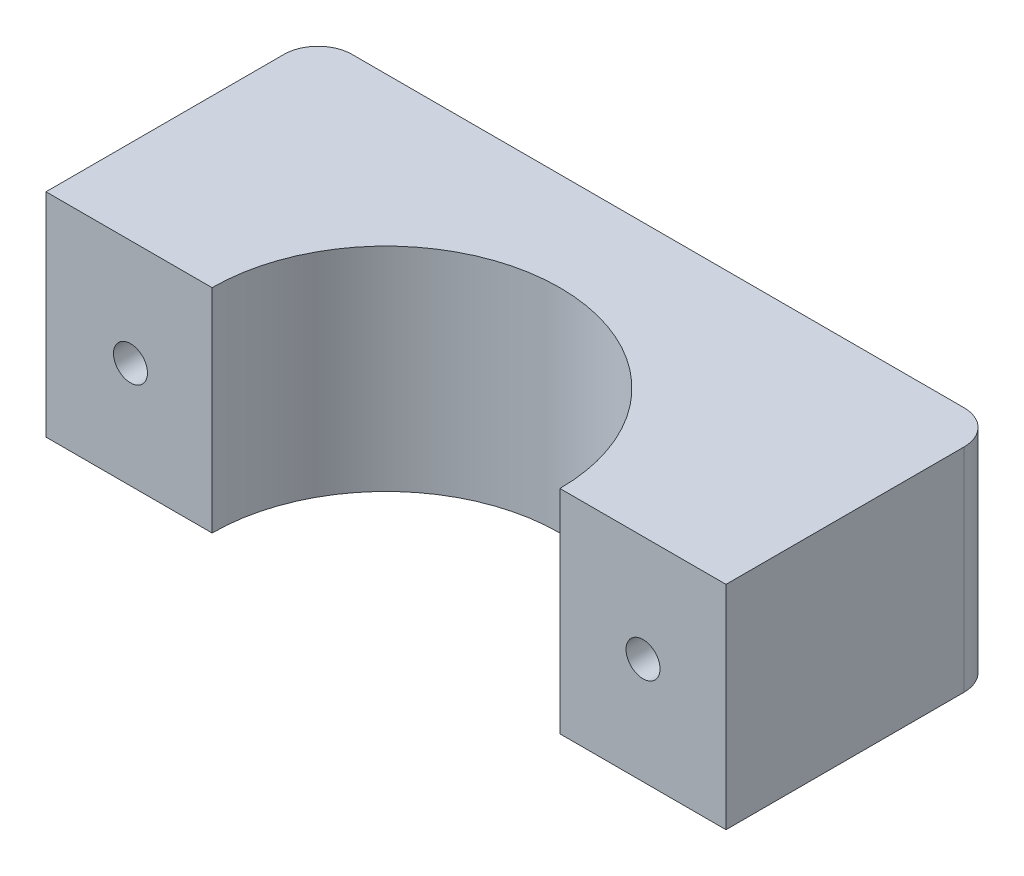
from build123d import *

# Parameters (mm, degrees)
BOSS_EXTRUDE1_DEPTH = 15.875
SKETCH2_R           = 1.27
CUT_EXTRUDE1_DEPTH  = 57.969799236
SKETCH3_R           = 3.81
CUT_EXTRUDE2_DEPTH  = 4.1275


with BuildPart() as part:
    # Sketch1 → Boss-Extrude1 (new body)
    with BuildSketch(Plane(origin=(0, 0, 0), x_dir=(1, 0, 0), z_dir=(0, 1, 0))):
        with BuildLine():
            Line((48.26, 0), (2.54, 0))
            ThreePointArc((2.54, 0), (0.743948776, -0.743948776), (0, -2.54))
            Line((0, -2.54), (0, -20.32))
            Line((0, -20.32), (12.4079, -20.32))
            ThreePointArc((12.4079, -20.32), (25.4, -7.3279), (38.3921, -20.32))
            Line((38.3921, -20.32), (50.8, -20.32))
            Line((50.8, -20.32), (50.8, -2.54))
            ThreePointArc((50.8, -2.54), (50.056051224, -0.743948776), (48.26, 0))
        make_face()
    extrude(amount=BOSS_EXTRUDE1_DEPTH)

    # Sketch2 → Cut-Extrude1 (cut, through all)
    with BuildSketch(Plane.XY.offset(20.32)):
        with Locations((6.3119, 7.9375)):
            Circle(SKETCH2_R)
        with Locations((44.6024, 7.9375)):
            Circle(SKETCH2_R)
    extrude(amount=-CUT_EXTRUDE1_DEPTH, mode=Mode.SUBTRACT)

    # Sketch3 → Cut-Extrude2 (cut)
    with BuildSketch(Plane(origin=(0, 0, 0), x_dir=(-1, 0, 0), z_dir=(0, 0, -1))):
        with Locations((-44.6024, 7.9375)):
            Circle(SKETCH3_R)
        with Locations((-6.3119, 7.9375)):
            Circle(SKETCH3_R)
    extrude(amount=-CUT_EXTRUDE2_DEPTH, mode=Mode.SUBTRACT)


solid = part.part
